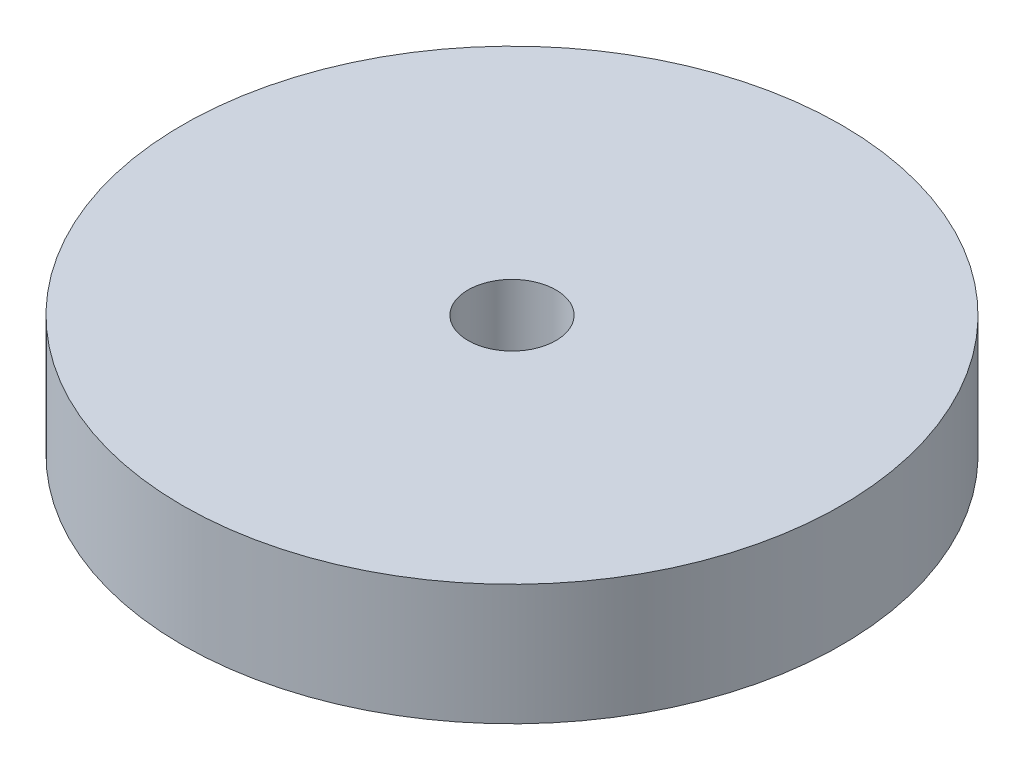
from build123d import *

# Parameters (mm, degrees)
SKETCH_1_R          = 15
EXTRUDE_1_DEPTH     = 5.5
SKETCH_2_R          = 2
CUT_EXTRUDE_1_DEPTH = 22.914607001


with BuildPart() as part:
    # ｽｹｯﾁ1 → ﾎﾞｽ - 押し出し1 (new body)
    with BuildSketch(Plane(origin=(0, 0, 0), x_dir=(1, 0, 0), z_dir=(0, 1, 0))):
        with Locations(Location((0, 0, 0), (0, 0, 270))):
            Circle(SKETCH_1_R)
    extrude(amount=EXTRUDE_1_DEPTH)

    # ｽｹｯﾁ2 → ｶｯﾄ - 押し出し1 (cut, through all)
    with BuildSketch(Plane(origin=(0, 5.5, 0), x_dir=(1, 0, 0), z_dir=(0, 1, 0))):
        with Locations(Location((0, 0, 0), (0, 0, 270))):
            Circle(SKETCH_2_R)
    extrude(amount=-CUT_EXTRUDE_1_DEPTH, mode=Mode.SUBTRACT)


solid = part.part
